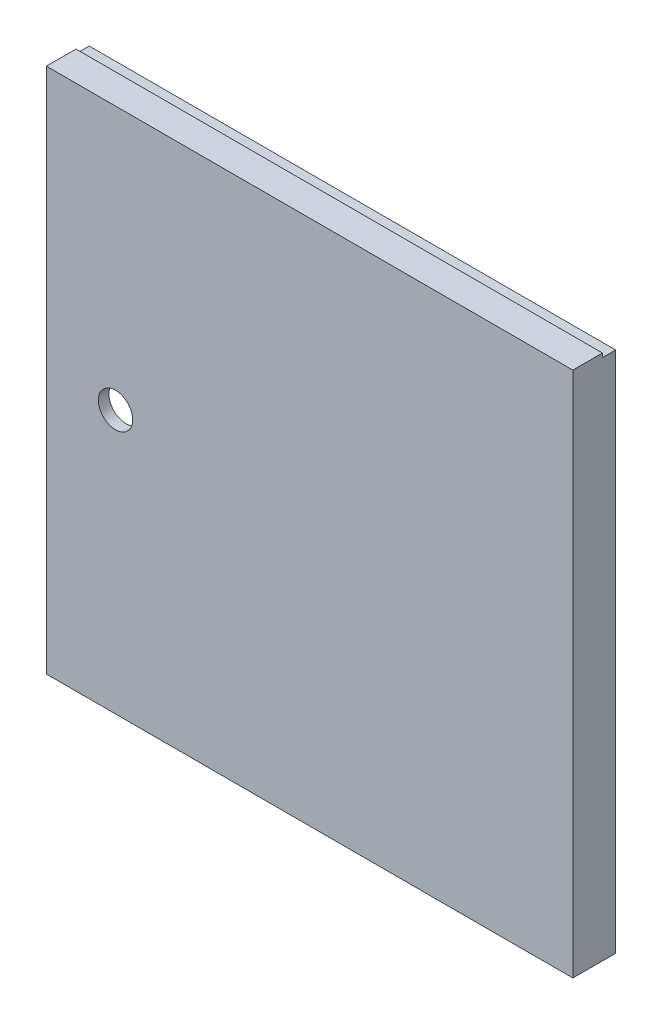
from build123d import *

# Parameters (mm, degrees)
SKETCH2_W           = 101.6
SKETCH2_H           = 101.6
BOSS_EXTRUDE1_DEPTH = 8.255
SKETCH3_W           = 97.536
SKETCH3_H           = 97.536
CUT_EXTRUDE1_DEPTH  = 6.223
SKETCH4_R           = 3.311109117
CUT_EXTRUDE2_DEPTH  = 2.032
SKETCH8_W           = 2.54
SKETCH8_H           = 0.762
CUT_EXTRUDE3_DEPTH  = 114.891812809


with BuildPart() as part:
    # Sketch2 → Boss-Extrude1 (new body)
    with BuildSketch(Plane.XY):
        Rectangle(SKETCH2_W, SKETCH2_H)
    extrude(amount=BOSS_EXTRUDE1_DEPTH)

    # Sketch3 → Cut-Extrude1 (cut)
    with BuildSketch(Plane(origin=(0, 0, 0), x_dir=(-1, 0, 0), z_dir=(0, 0, -1))):
        Rectangle(SKETCH3_W, SKETCH3_H)
    extrude(amount=-CUT_EXTRUDE1_DEPTH, mode=Mode.SUBTRACT)

    # Sketch4 → Cut-Extrude2 (cut)
    with BuildSketch(Plane.XY.offset(8.255)):
        with Locations((-37.456490902, 0)):
            Circle(SKETCH4_R)
    extrude(amount=-CUT_EXTRUDE2_DEPTH, mode=Mode.SUBTRACT)

    # Sketch8 → Cut-Extrude3 (cut, through all)
    with BuildSketch(Plane(origin=(50.8, 0, 0), x_dir=(0, 0, -1), z_dir=(1, 0, 0))):
        with Locations((-1.27, 50.419)):
            Rectangle(SKETCH8_W, SKETCH8_H)
    extrude(amount=-CUT_EXTRUDE3_DEPTH, mode=Mode.SUBTRACT)


solid = part.part
